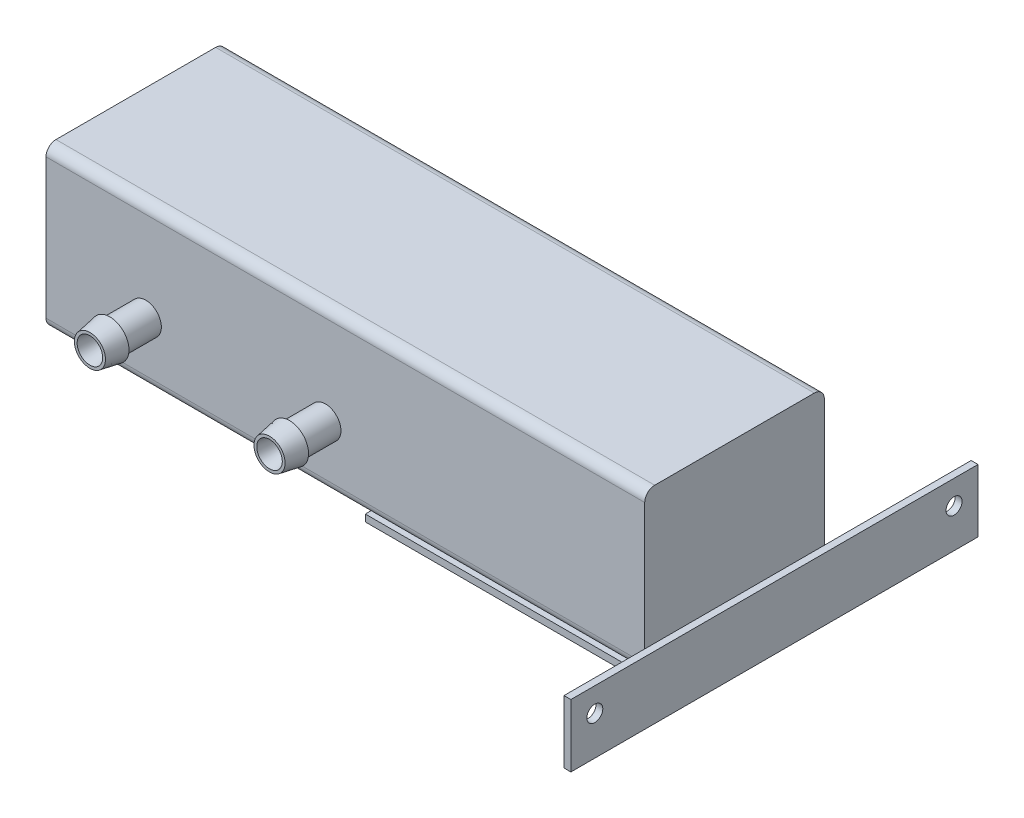
from build123d import *

# Parameters (mm, degrees)
SKETCH1_W                     = 190.5
SKETCH1_H                     = 50.8
BOSS_EXTRUDE1_DEPTH           = 28.575
SKETCH2_R                     = 4.953
SKETCH2_R_2                   = 4.064
BOSS_EXTRUDE2_DEPTH           = 17.78
SKETCH3_R                     = 4.953
SKETCH3_R_2                   = 4.064
BOSS_EXTRUDE3_DEPTH           = 6.35
BOSS_EXTRUDE3_DRAFT           = 10
BOSS_EXTRUDE3_PROFILE_2_DEPTH = 6.35
BOSS_EXTRUDE3_PROFILE_2_DRAFT = 10
BOSS_EXTRUDE4_DEPTH           = 57.15
SKETCH7_W                     = 2.188600317
SKETCH7_H                     = 19.968600317
BOSS_EXTRUDE5_DEPTH           = 64.77
SKETCH8_R                     = 2.54
CUT_EXTRUDE1_DEPTH            = 213.983254201
FILLET1_R                     = 3.175


with BuildPart() as part:
    # Sketch1 → Boss-Extrude1 (new, symmetric)
    with BuildSketch(Plane.XY):
        Rectangle(SKETCH1_W, SKETCH1_H)
    extrude(amount=BOSS_EXTRUDE1_DEPTH, both=True)

    # Sketch2 → Boss-Extrude2 (add)
    # profile 1 of 2: a face of its own
    with BuildSketch(Plane.XY.offset(28.575)):
        with Locations((-63.5, -6.35)):
            Circle(SKETCH2_R)
        with Locations((-63.5, -6.35)):
            Circle(SKETCH2_R_2, mode=Mode.SUBTRACT)
    # profile 2 of 2: a face of its own
    with BuildSketch(Plane.XY.offset(28.575)):
        with Locations((-6.35, -6.35)):
            Circle(SKETCH2_R)
        with Locations((-6.35, -6.35)):
            Circle(SKETCH2_R_2, mode=Mode.SUBTRACT)
    extrude(amount=BOSS_EXTRUDE2_DEPTH)


with BuildPart() as boss_extrude3_tool:
    # Sketch3 → Boss-Extrude3 (with draft: the straight prism first)
    with BuildSketch(Plane.XY.offset(46.355)):
        with Locations((-63.5, -6.35)):
            Circle(SKETCH3_R)
        with Locations((-63.5, -6.35)):
            Circle(SKETCH3_R_2, mode=Mode.SUBTRACT)
    extrude(amount=-BOSS_EXTRUDE3_DEPTH)
    # Boss-Extrude3: the draft: its side faces are tilted about the plane it starts from
    boss_extrude3_sides = [boss_extrude3_tool.faces().sort_by_distance(p)[0] for p in [
        (-68.453, -6.35, 43.18),
        (-67.564, -6.35, 43.18),
    ]]
    draft(boss_extrude3_sides, Plane.XY.offset(46.355), BOSS_EXTRUDE3_DRAFT)


with BuildPart() as part_1:
    add(part.part)

    # Boss-Extrude3: add boss_extrude3_tool
    add(boss_extrude3_tool.part)


with BuildPart() as boss_extrude3_profile_2_tool:
    # Sketch3 → Boss-Extrude3 profile 2 (with draft: the straight prism first)
    with BuildSketch(Plane.XY.offset(46.355)):
        with Locations((-6.35, -6.35)):
            Circle(SKETCH3_R)
        with Locations((-6.35, -6.35)):
            Circle(SKETCH3_R_2, mode=Mode.SUBTRACT)
    extrude(amount=-BOSS_EXTRUDE3_PROFILE_2_DEPTH)
    # Boss-Extrude3 profile 2: the draft: its side faces are tilted about the plane it starts from
    boss_extrude3_profile_2_sides = [boss_extrude3_profile_2_tool.faces().sort_by_distance(p)[0] for p in [
        (-11.303, -6.35, 43.18),
        (-10.414, -6.35, 43.18),
    ]]
    draft(boss_extrude3_profile_2_sides, Plane.XY.offset(46.355), BOSS_EXTRUDE3_PROFILE_2_DRAFT)


with BuildPart() as part_2:
    add(part_1.part)

    # Boss-Extrude3 profile 2: add boss_extrude3_profile_2_tool
    add(boss_extrude3_profile_2_tool.part)

    # Fillet1
    fillet1_edges = [part_2.edges().sort_by_distance(p)[0] for p in [
        (0, -25.4, 28.575),
        (0, -25.4, -28.575),
        (0, 25.4, -28.575),
        (0, 25.4, 28.575),
    ]]
    fillet(fillet1_edges, radius=FILLET1_R)


with BuildPart() as body_2:
    # Sketch5 → Boss-Extrude4 (new body)
    with BuildSketch(Plane.XY.offset(28.575)):
        Polygon((6.35, -25.4), (105.761399683, -25.4), (105.761399683, -7.62), (107.95, -7.62), (107.95, -25.4), (107.95, -27.588600317), (6.35, -27.588600317), align=None)
    extrude(amount=-BOSS_EXTRUDE4_DEPTH)

    # Sketch7 → Boss-Extrude5 (add, symmetric)
    with BuildSketch(Plane.XY):
        with Locations((106.855699842, -17.604300158)):
            Rectangle(SKETCH7_W, SKETCH7_H)
    extrude(amount=BOSS_EXTRUDE5_DEPTH, both=True)

    # Sketch8 → Cut-Extrude1 (cut, through all)
    with BuildSketch(Plane.ZY.offset(-105.761399683)):
        with Locations((57.15, -15.24)):
            Circle(SKETCH8_R)
        with Locations((-57.15, -15.24)):
            Circle(SKETCH8_R)
    extrude(amount=-CUT_EXTRUDE1_DEPTH, mode=Mode.SUBTRACT)


solid = Compound([part_2.part, body_2.part])
